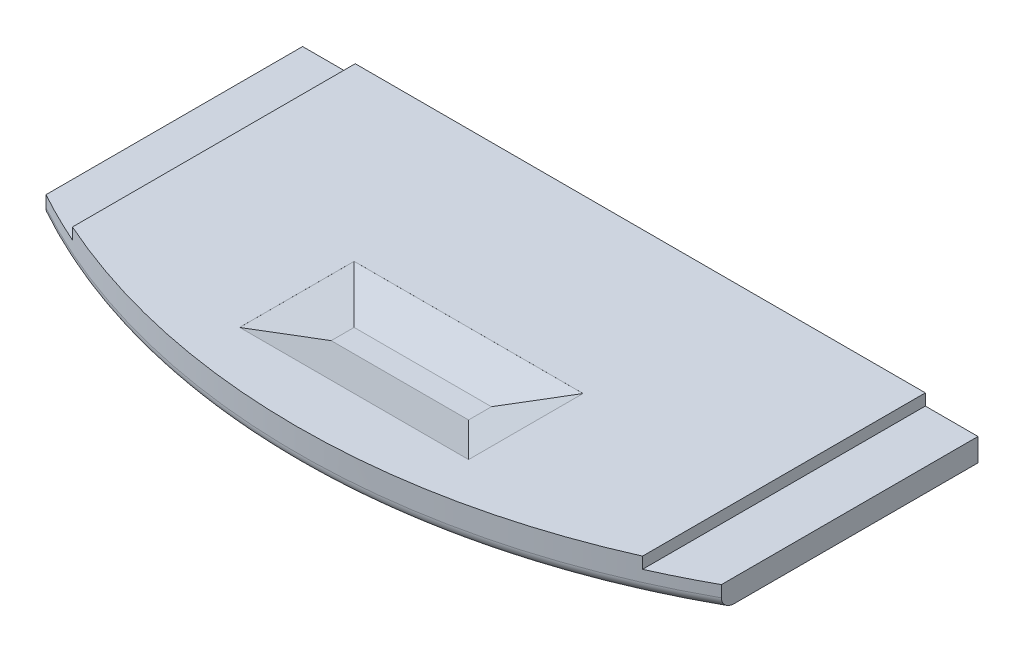
from build123d import *

# Parameters (mm, degrees)
BOSS_EXTRUDE1_DEPTH = 19.05
SKETCH2_W           = 12.7
SKETCH2_H           = 6.35
CUT_EXTRUDE1_DEPTH  = 0.635
CHAMFER1_SIZE       = 2.54
CHAMFER1_SIZE2      = 0.633293127
CUT_EXTRUDE2_DEPTH  = 27.785034651
FILLET1_R           = 0.635


with BuildPart() as part:
    # Sketch1 → Boss-Extrude1 (new body)
    with BuildSketch(Plane.XY):
        Polygon((-18.7325, 0), (18.7325, 0), (18.7325, 1.27), (15.8115, 1.27), (15.8115, 1.905), (-15.8115, 1.905), (-15.8115, 1.27), (-18.7325, 1.27), align=None)
    extrude(amount=BOSS_EXTRUDE1_DEPTH)

    # Sketch2 → Cut-Extrude1 (cut)
    with BuildSketch(Plane(origin=(0, 1.905, 0), x_dir=(1, 0, 0), z_dir=(0, 1, 0))):
        with Locations((0, -12.7)):
            Rectangle(SKETCH2_W, SKETCH2_H)
    extrude(amount=-CUT_EXTRUDE1_DEPTH, mode=Mode.SUBTRACT)

    # Chamfer1
    chamfer1_edges = [part.edges().sort_by_distance(p)[0] for p in [
        (6.35, 1.27, 12.7),
        (0, 1.27, 15.875),
        (-6.35, 1.27, 12.7),
        (0, 1.27, 9.525),
    ]]
    chamfer1_side = [part.faces().sort_by_distance(p)[0] for p in [
        (0, 1.27, 12.7),
    ]]
    chamfer(chamfer1_edges, length=CHAMFER1_SIZE, length2=CHAMFER1_SIZE2, reference=chamfer1_side[0])

    # Sketch3 → Cut-Extrude2 (cut, through all)
    with BuildSketch(Plane(origin=(0, 1.905, 0), x_dir=(1, 0, 0), z_dir=(0, 1, 0))):
        with BuildLine():
            Line((-18.7325, -21.59), (18.7325, -21.59))
            Line((18.7325, -21.59), (18.7325, -14.233613746))
            ThreePointArc((18.7325, -14.233613746), (0, -19.05), (-18.7325, -14.233613746))
            Line((-18.7325, -14.233613746), (-18.7325, -21.59))
        make_face()
    extrude(amount=-CUT_EXTRUDE2_DEPTH, mode=Mode.SUBTRACT)

    # Fillet1
    fillet1_edges = [part.edges().sort_by_distance(p)[0] for p in [
        (0, 0, 19.05),
    ]]
    fillet(fillet1_edges, radius=FILLET1_R)


solid = part.part
